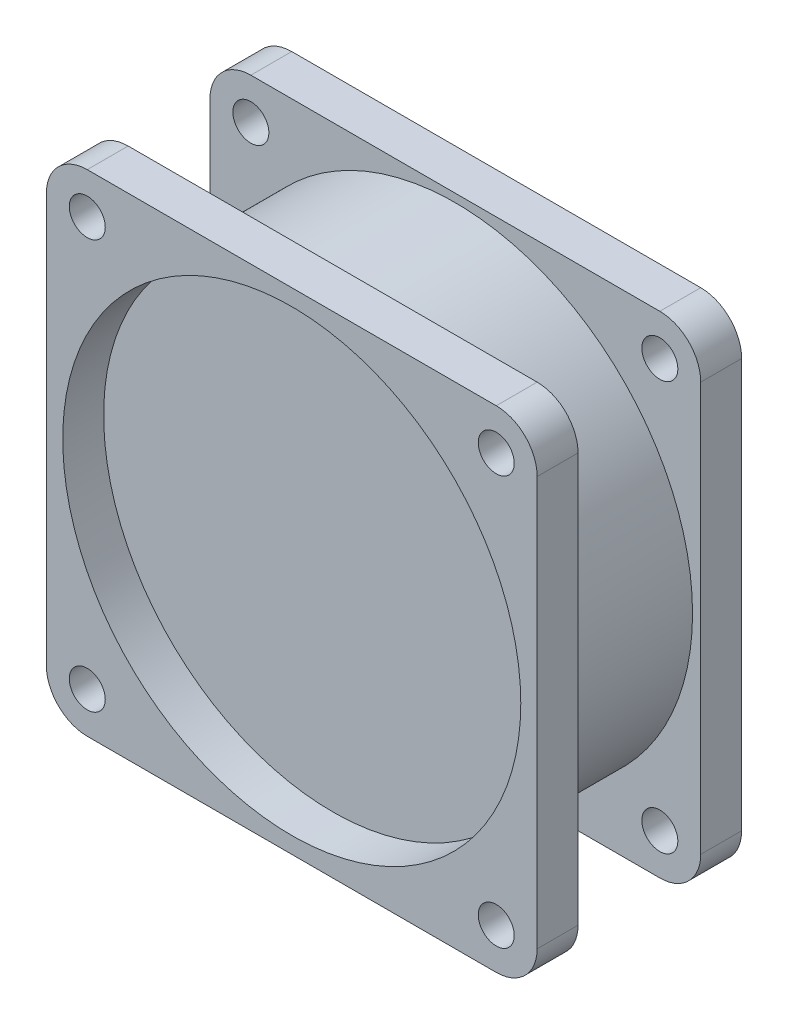
from build123d import *

# Parameters (mm, degrees)
SKETCH_1_W          = 60
SKETCH_1_H          = 60
EXTRUDE_1_DEPTH     = 5
SKETCH_3_R          = 29
EXTRUDE_2_DEPTH     = 15
SKETCH_4_W          = 60
SKETCH_4_H          = 60
EXTRUDE_3_DEPTH     = 5
FILLET_1_R          = 5
SKETCH_5_R          = 2.2
CUT_EXTRUDE_1_DEPTH = 89.459030065
SKETCH_6_R          = 28
CUT_EXTRUDE_4_DEPTH = 5
CUT_EXTRUDE_START   = -5
SKETCH_7_R          = 28
CUT_EXTRUDE_5_DEPTH = 5


with BuildPart() as part:
    # Эскиз1 → Бобышка-Вытянуть1 (new body)
    with BuildSketch(Plane.XY):
        with Locations((-30, -30)):
            Rectangle(SKETCH_1_W, SKETCH_1_H)
    extrude(amount=EXTRUDE_1_DEPTH)

    # Эскиз3 → Бобышка-Вытянуть2 (add)
    with BuildSketch(Plane(origin=(0, 0, 0), x_dir=(-1, 0, 0), z_dir=(0, 0, -1))):
        with Locations((30, -30)):
            Circle(SKETCH_3_R)
    extrude(amount=EXTRUDE_2_DEPTH)

    # Эскиз4 → Бобышка-Вытянуть3 (add)
    with BuildSketch(Plane(origin=(0, 0, -15), x_dir=(-1, 0, 0), z_dir=(0, 0, -1))):
        with Locations((30, -30)):
            Rectangle(SKETCH_4_W, SKETCH_4_H)
    extrude(amount=EXTRUDE_3_DEPTH)

    # Скругление1
    fillet_1_edges = [part.edges().sort_by_distance(p)[0] for p in [
        (-60, -60, 2.5),
        (-60, -60, -17.5),
        (0, -60, -17.5),
        (0, -60, 2.5),
        (0, 0, -17.5),
        (-60, 0, -17.5),
        (-60, 0, 2.5),
        (0, 0, 2.5),
    ]]
    fillet(fillet_1_edges, radius=FILLET_1_R)

    # Эскиз5 → Вырез-Вытянуть1 (cut, through all)
    with BuildSketch(Plane.XY.offset(5)):
        with Locations((-55, -5)):
            Circle(SKETCH_5_R)
        with Locations((-5, -5)):
            Circle(SKETCH_5_R)
        with Locations((-5, -55)):
            Circle(SKETCH_5_R)
        with Locations((-55, -55)):
            Circle(SKETCH_5_R)
    extrude(amount=-CUT_EXTRUDE_1_DEPTH, mode=Mode.SUBTRACT)

    # Эскиз6 → Вырез-Вытянуть4 (cut)
    with BuildSketch(Plane(origin=(0, 0, -20), x_dir=(-1, 0, 0), z_dir=(0, 0, -1))):
        with Locations((30, -30)):
            Circle(SKETCH_6_R)
    extrude(amount=-CUT_EXTRUDE_4_DEPTH, mode=Mode.SUBTRACT)

    # Эскиз7 → Вырез-Вытянуть5 (cut)
    with BuildSketch(Plane.XY.offset(5).offset(CUT_EXTRUDE_START)):
        with Locations((-30, -30)):
            Circle(SKETCH_7_R)
    extrude(amount=CUT_EXTRUDE_5_DEPTH, mode=Mode.SUBTRACT)


solid = part.part
